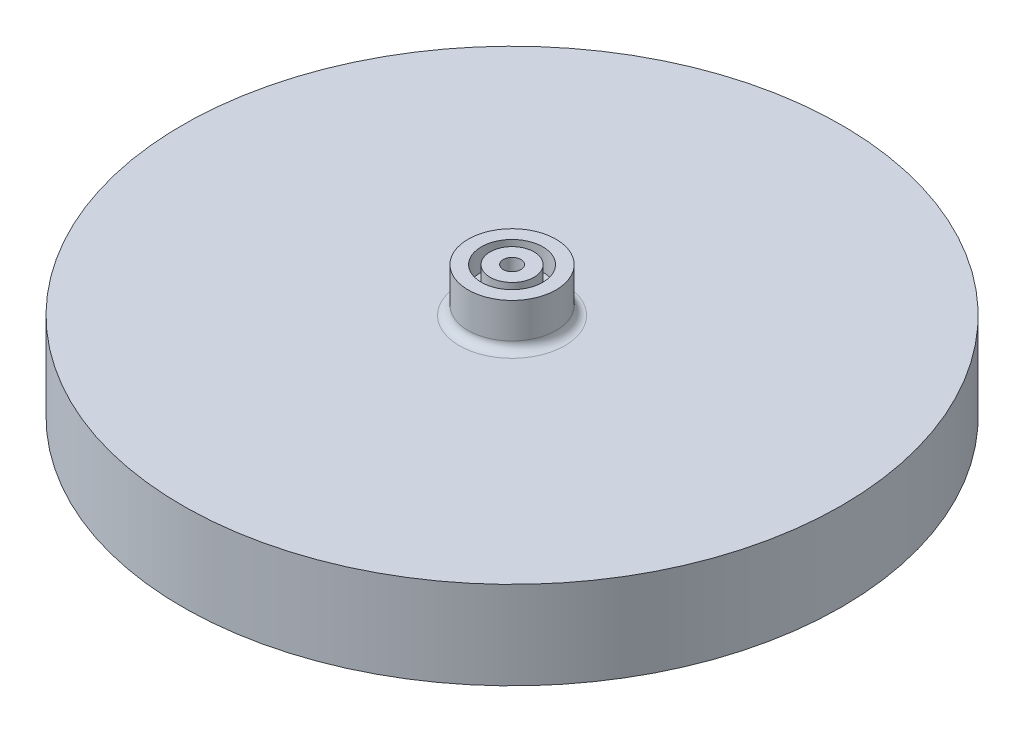
from build123d import *

# Parameters (mm, degrees)
FILLET_1_R = 2


with BuildPart() as part:
    # 草图1 → 旋转1 (revolve)
    with BuildSketch(Plane.XY, mode=Mode.PRIVATE) as revolve_1_sk:
        Polygon((0, 0), (-2, 0), (-2, 8), (-5, 8), (-5, 3), (-7, 3), (-7, 8), (-10, 8), (-10, -2), (-75, -2), (-75, -22), (0, -22), align=None)
    revolve(revolve_1_sk.sketch.rotate(Axis((0, -198.175933826, 0), (0, 1, 0)), 180), axis=Axis((0, -198.175933826, 0), (0, 1, 0)))

    # 圆角1
    fillet_1_edges = [part.edges().sort_by_distance(p)[0] for p in [
        (-10, -2, 0),
    ]]
    fillet(fillet_1_edges, radius=FILLET_1_R)


solid = part.part
